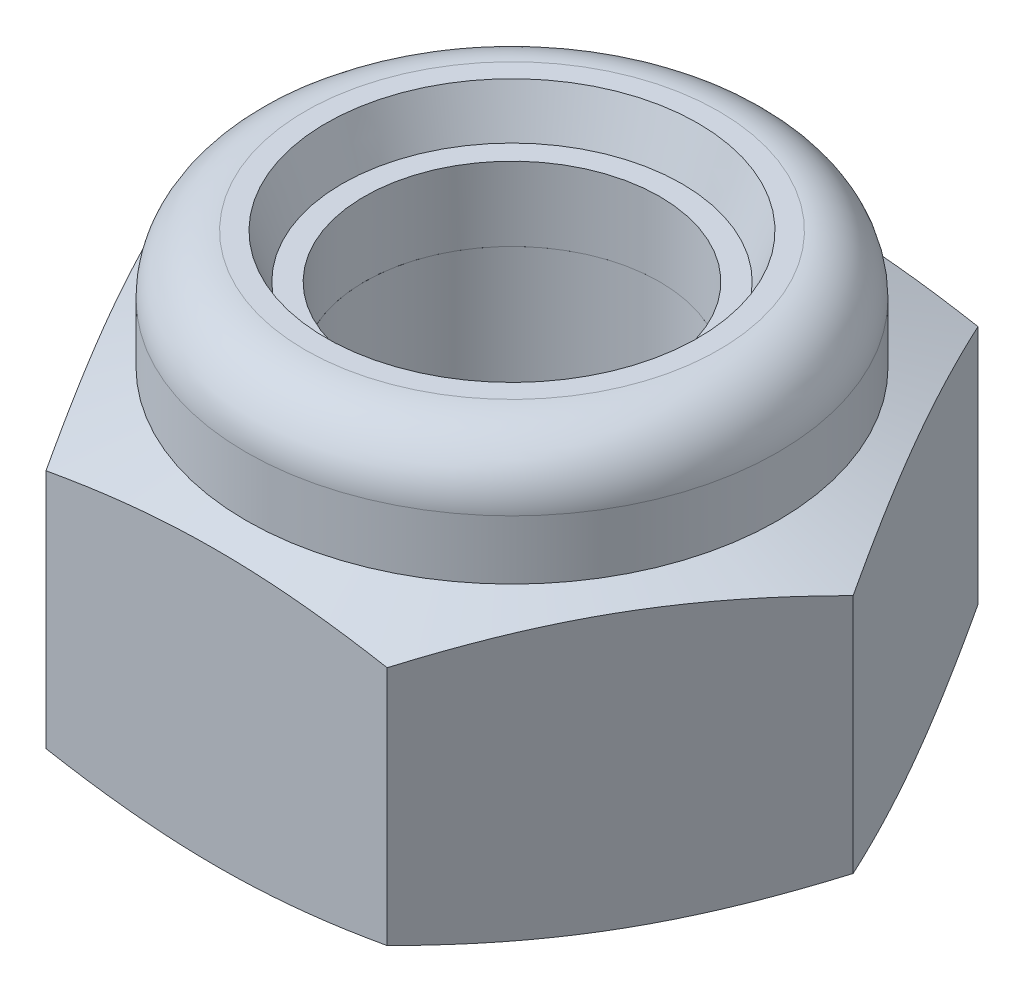
from build123d import *

# Parameters (mm, degrees)
SKETCH_2_R      = 1.3
EXTRUDE_1_DEPTH = 2
SKETCH_4_R      = 1.3
SKETCH_4_R_2    = 1
EXTRUDE_2_DEPTH = 0.5


with BuildPart() as part:
    # 草图1 → 旋转1 (revolve)
    with BuildSketch(Plane.XY, mode=Mode.PRIVATE) as revolve_1_sk:
        with BuildLine():
            Line((1, 2), (1, 0.173205081))
            Line((1, 0.173205081), (1.3, 0))
            Line((1.3, 0), (1.8, 0))
            Line((1.8, 0), (1.8, 2.4))
            ThreePointArc((1.8, 2.4), (1.682842712, 2.682842712), (1.4, 2.8))
            Line((1.4, 2.8), (1.25919107, 2.8))
            Line((1.25919107, 2.8), (1.15, 2.5))
            Line((1.15, 2.5), (1.3, 2.5))
            Line((1.3, 2.5), (1.3, 2))
            Line((1.3, 2), (1, 2))
        make_face()
    revolve(revolve_1_sk.sketch.rotate(Axis((0, -0.04163543, 0), (0, 1, 0)), 90), axis=Axis((0, -0.04163543, 0), (0, 1, 0)))

    # 草图2 → 凸台-拉伸1 (add)
    with BuildSketch(Plane(origin=(0, 0, 0), x_dir=(1, 0, 0), z_dir=(0, 1, 0))):
        Polygon((2.309401077, 0), (1.154700538, 2), (-1.154700538, 2), (-2.309401077, 0), (-1.154700538, -2), (1.154700538, -2), align=None)
        with Locations(Location((0, 0, 0), (0, 0, 90))):
            Circle(SKETCH_2_R, mode=Mode.SUBTRACT)
    extrude(amount=EXTRUDE_1_DEPTH)

    # 草图3 → 切除-旋转1 (revolve, cut)
    with BuildSketch(Plane.XY, mode=Mode.PRIVATE) as cut_revolve_1_sk:
        Polygon((-1.8, 2), (-2.309401077, 1.814593171), (-2.309401077, 2), align=None)
        Polygon((-1.8, 0), (-2.309401077, 0), (-2.309401077, 0.185406829), align=None)
    revolve(cut_revolve_1_sk.sketch.rotate(Axis((0, 0, 0), (0, 1, 0)), 119.999999948), axis=Axis((0, 0, 0), (0, 1, 0)), mode=Mode.SUBTRACT)


with BuildPart() as body_2:
    # 草图4 → 凸台-拉伸2 (new body)
    with BuildSketch(Plane(origin=(0, 2, 0), x_dir=(1, 0, 0), z_dir=(0, 1, 0))):
        with Locations(Location((0, 0, 0), (0, 0, 90))):
            Circle(SKETCH_4_R)
        with Locations(Location((0, 0, 0), (0, 0, 90))):
            Circle(SKETCH_4_R_2, mode=Mode.SUBTRACT)
    extrude(amount=EXTRUDE_2_DEPTH)


solid = Compound([part.part, body_2.part])
